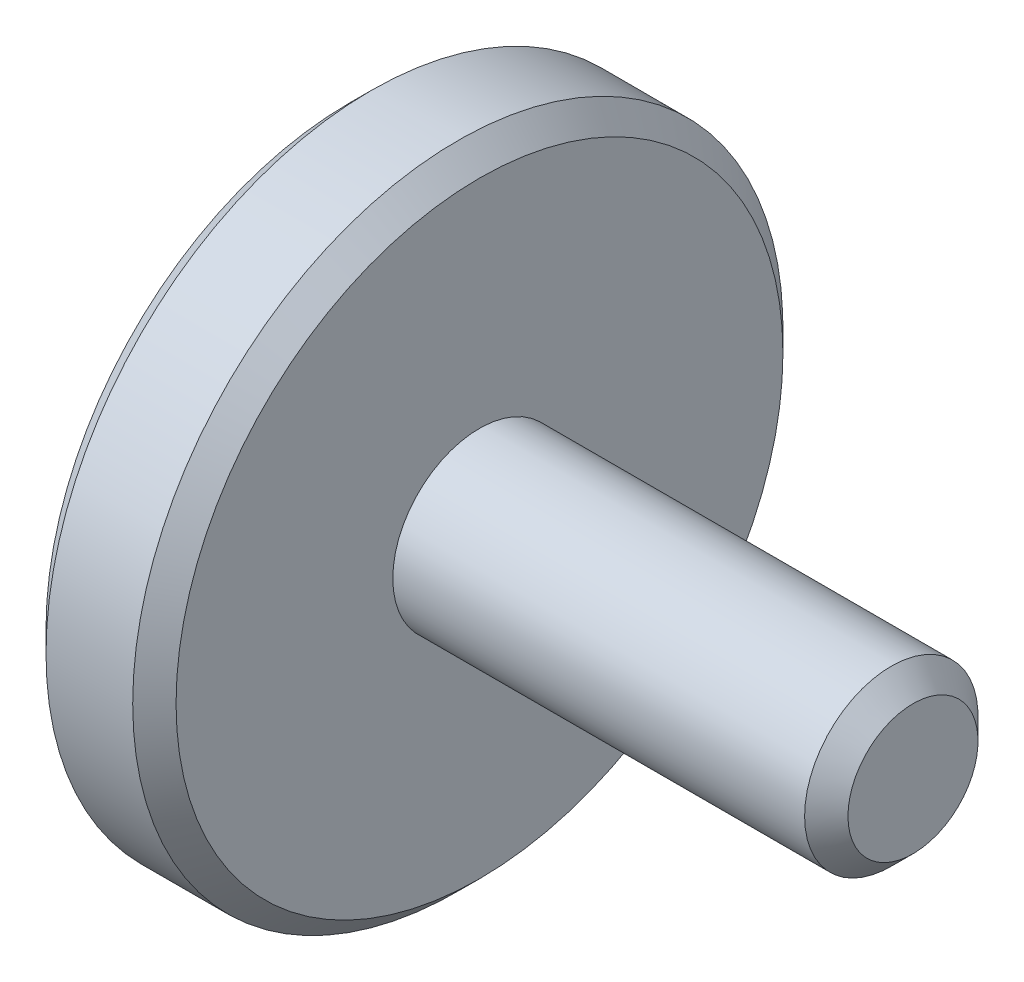
from build123d import *

# Parameters (mm, degrees)
CHANFREIN1_SIZE = 0.5


with BuildPart() as part:
    # Esquisse1 → Révolution1 (revolve)
    with BuildSketch(Plane.XY, mode=Mode.PRIVATE) as r_volution1_sk:
        Polygon((0, 0), (0, 7.5), (3, 7.5), (3, 2), (13, 2), (13, 0), align=None)
    revolve(r_volution1_sk.sketch.rotate(Axis((-65.170410524, 0, 0), (1, 0, 0)), 90), axis=Axis((-65.170410524, 0, 0), (1, 0, 0)))

    # Chanfrein1
    chanfrein1_edges = [part.edges().sort_by_distance(p)[0] for p in [
        (13, 0, -2),
        (3, 0, -7.5),
        (0, 0, -7.5),
    ]]
    chamfer(chanfrein1_edges, length=CHANFREIN1_SIZE)


solid = part.part
